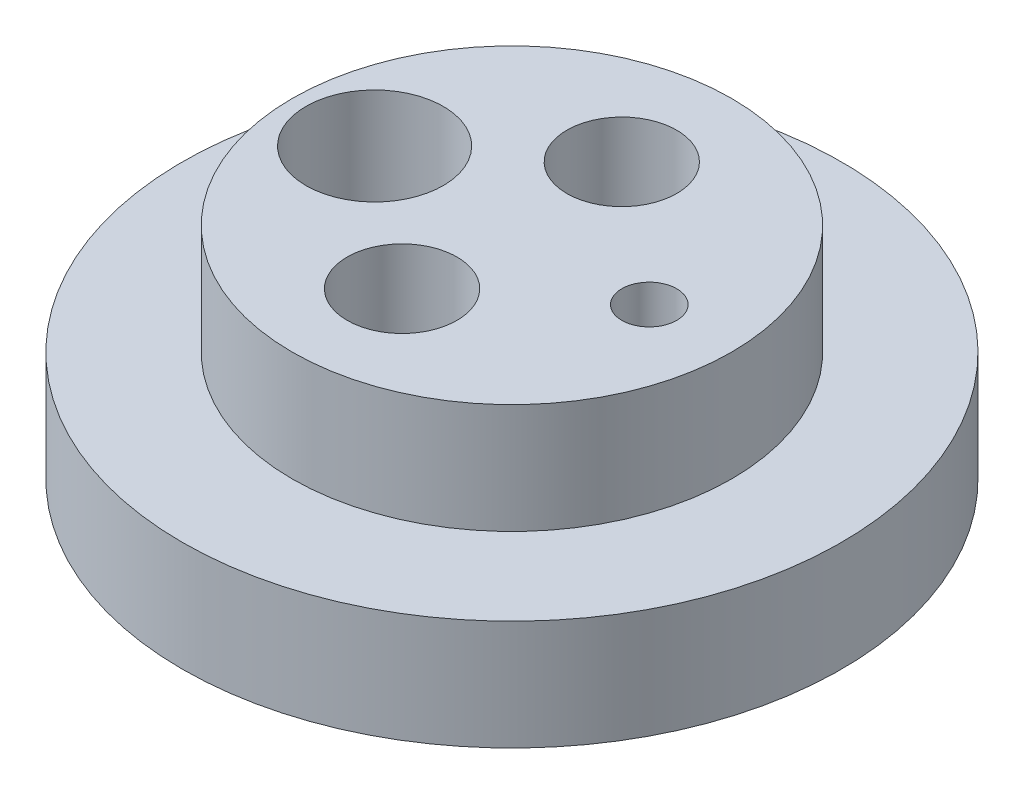
from build123d import *

# Parameters (mm, degrees)
SKETCH_1_R          = 24
EXTRUDE_1_DEPTH     = 8
SKETCH_2_R          = 16
EXTRUDE_2_DEPTH     = 8
SKETCH_4_R          = 5
SKETCH_4_R_2        = 4
SKETCH_4_R_3        = 2
CUT_EXTRUDE_1_DEPTH = 38.523326079


with BuildPart() as part:
    # 草图1 → 凸台-拉伸1 (new body)
    with BuildSketch(Plane(origin=(0, 0, 0), x_dir=(1, 0, 0), z_dir=(0, 1, 0))):
        with Locations(Location((0, 0, 0), (0, 0, 270))):
            Circle(SKETCH_1_R)
    extrude(amount=EXTRUDE_1_DEPTH)

    # 草图2 → 凸台-拉伸2 (add)
    with BuildSketch(Plane(origin=(0, 8, 0), x_dir=(1, 0, 0), z_dir=(0, 1, 0))):
        with Locations(Location((0, 0, 0), (0, 0, 270))):
            Circle(SKETCH_2_R)
    extrude(amount=EXTRUDE_2_DEPTH)

    # 草图4 → 切除-拉伸1 (cut, through all)
    with BuildSketch(Plane(origin=(0, 16, 0), x_dir=(1, 0, 0), z_dir=(0, 1, 0))):
        with Locations(Location((-10, 0, 0), (0, 0, 270))):
            Circle(SKETCH_4_R)
        with Locations(Location((0, 8, 0), (0, 0, 270))):
            Circle(SKETCH_4_R_2)
        with Locations(Location((0, -8, 0), (0, 0, 270))):
            Circle(SKETCH_4_R_2)
        with Locations(Location((10, 0, 0), (0, 0, 270))):
            Circle(SKETCH_4_R_3)
    extrude(amount=-CUT_EXTRUDE_1_DEPTH, mode=Mode.SUBTRACT)


solid = part.part
